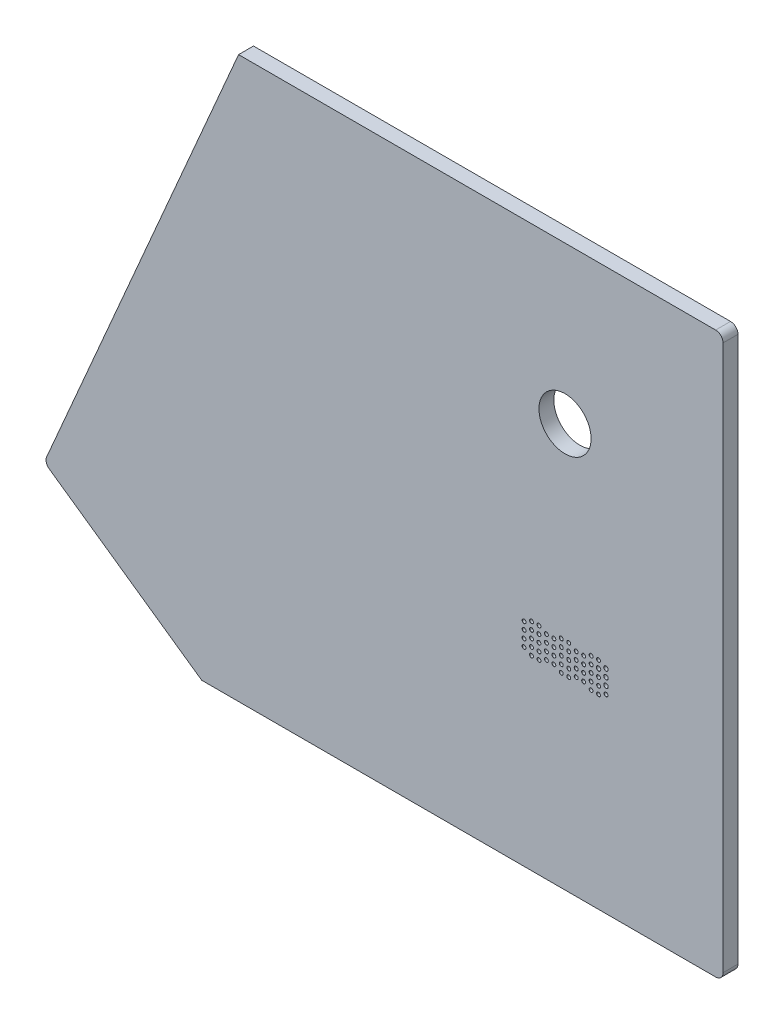
from build123d import *

# Parameters (mm, degrees)
RESSALTO_EXTRUS_O1_DEPTH                 = 4
ESBO_O2_R                                = 0.5
CORTE_EXTRUS_O1_DEPTH                    = 206.554088373
ESBO_O2_7_R                              = 0.5
CORTE_EXTRUS_O2_DEPTH                    = 206.554088373
ESBO_O2_9_R                              = 7
CORTE_EXTRUS_O3_DEPTH                    = 206.554088373
ESBO_O2_10_R                             = 0.5
CORTE_EXTRUS_O4_DEPTH                    = 206.554088373
ESBO_O2_11_R                             = 0.5
CORTE_EXTRUS_O5_DEPTH                    = 206.554088373
FURO_DE_DI_METRO_1_15_1_15_1_D           = 1.15
FURO_DE_DI_METRO_1_15_1_15_1_CSINK_D     = 1.2
FURO_DE_DI_METRO_1_15_1_15_1_CSINK_ANGLE = 90
FURO_DE_DI_METRO_1_0_1_1_D               = 1
FURO_DE_DI_METRO_1_0_1_1_CSINK_D         = 1.05
FURO_DE_DI_METRO_1_0_1_1_CSINK_ANGLE     = 90


with BuildPart() as part:
    # Esboço1 → Ressalto-extrusão1 (new body)
    with BuildSketch(Plane.XY):
        with BuildLine():
            Line((0, 0), (138, 0))
            ThreePointArc((138, 0), (139.414213562, 0.585786438), (140, 2))
            Line((140, 2), (140, 148.454256327))
            ThreePointArc((140, 148.454256327), (139.414213562, 149.86846989), (138, 150.454256327))
            Line((138, 150.454256327), (9.899407771, 150.454256327))
            Line((9.899407771, 150.454256327), (-41.646512669, 31.110140067))
            ThreePointArc((-41.646512669, 31.110140067), (-41.734695124, 29.77189369), (-40.957602214, 28.678821818))
            Line((-40.957602214, 28.678821818), (0, 0))
        make_face()
    extrude(amount=RESSALTO_EXTRUS_O1_DEPTH)

    # Esboço2 → Corte-extrusão1 (cut, through all)
    with BuildSketch(Plane.XY.offset(4)):
        with Locations((104.555415111, 50)):
            Circle(ESBO_O2_R)
    extrude(amount=-CORTE_EXTRUS_O1_DEPTH, mode=Mode.SUBTRACT)

    # Esboço2<7> → Corte-extrusão2 (cut, through all)
    with BuildSketch(Plane.XY.offset(4)):
        with Locations((100.555415111, 57)):
            Circle(ESBO_O2_7_R)
    extrude(amount=-CORTE_EXTRUS_O2_DEPTH, mode=Mode.SUBTRACT)

    # Esboço2<9> → Corte-extrusão3 (cut, through all)
    with BuildSketch(Plane.XY.offset(4)):
        with Locations((97.555415111, 108.436764235)):
            Circle(ESBO_O2_9_R)
    extrude(amount=-CORTE_EXTRUS_O3_DEPTH, mode=Mode.SUBTRACT)

    # Esboço2<10> → Corte-extrusão4 (cut, through all)
    with BuildSketch(Plane.XY.offset(4)):
        with Locations((88.555415111, 58)):
            Circle(ESBO_O2_10_R)
    extrude(amount=-CORTE_EXTRUS_O4_DEPTH, mode=Mode.SUBTRACT)

    # Esboço2<11> → Corte-extrusão5 (cut, through all)
    with BuildSketch(Plane.XY.offset(4)):
        with Locations((90.555415111, 58)):
            Circle(ESBO_O2_11_R)
    extrude(amount=-CORTE_EXTRUS_O5_DEPTH, mode=Mode.SUBTRACT)

    # Furo de diâmetro Ø1.15 (1.15)1 (through all)
    with Locations(Plane(origin=(106.555415111, 56, 4), x_dir=(1, 0, 0), z_dir=(0, 0, 1))):
        with Locations((0, 0), (2, 1), (2, -1), (2, -3)):
            CounterSinkHole(FURO_DE_DI_METRO_1_15_1_15_1_D / 2, FURO_DE_DI_METRO_1_15_1_15_1_CSINK_D / 2, counter_sink_angle=FURO_DE_DI_METRO_1_15_1_15_1_CSINK_ANGLE)

    # Furo de diâmetro Ø1.0 (1)1 (through all)
    with Locations(Plane(origin=(106.555415111, 58, 4), x_dir=(1, 0, 0), z_dir=(0, 0, 1))):
        with Locations((0, 0), (-2, 0), (-4, -1), (-6, -1), (-4, -3), (-2, -2), (-2, -4), (0, -4), (0, -6), (2, -7), (0, -8), (-2, -6), (-14, -1), (-14, -3), (-14, -5), (-14, -7), (-12, -7), (-10, -8), (-8, -8), (-6, -7), (-4, -7), (-4, -5), (-6, -5), (-6, -3), (-8, -2), (-8, 0), (-10, 0), (-10, -2), (-10, -4), (-8, -4), (-10, -6), (-8, -6), (-12, -5), (-12, -3), (-12, -1), (-18, 0), (-16, 0), (-20, -1), (-18, -2), (-16, -2), (-16, -4), (-16, -6), (-16, -8), (-18, -8), (-18, -6), (-18, -4), (-20, -3), (-20, -5), (-20, -7)):
            CounterSinkHole(FURO_DE_DI_METRO_1_0_1_1_D / 2, FURO_DE_DI_METRO_1_0_1_1_CSINK_D / 2, counter_sink_angle=FURO_DE_DI_METRO_1_0_1_1_CSINK_ANGLE)


solid = part.part
